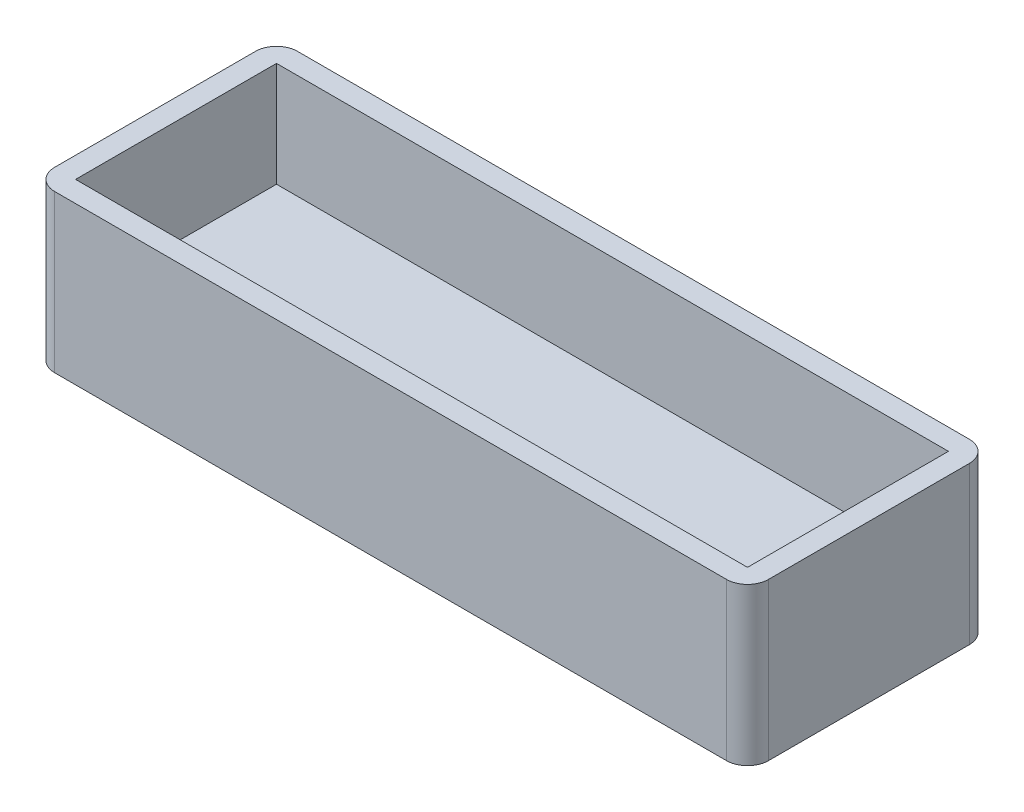
from build123d import *

# Parameters (mm, degrees)
SKETCH1_W           = 68.2
SKETCH1_H           = 23.2
SKETCH1_W_2         = 64.2
SKETCH1_H_2         = 19.2
BOSS_EXTRUDE1_DEPTH = 10
SKETCH1_2_W         = 68.2
SKETCH1_2_H         = 23.2
BOSS_EXTRUDE2_DEPTH = 5
SKETCH2_R           = 2.5
BOSS_EXTRUDE3_DEPTH = 5
FILLET1_R           = 2


with BuildPart() as part:
    # Sketch1 → Boss-Extrude1 (new body)
    with BuildSketch(Plane(origin=(0, 0, 0), x_dir=(1, 0, 0), z_dir=(0, 1, 0))):
        with Locations((32.1, 9.6)):
            Rectangle(SKETCH1_W, SKETCH1_H)
        with Locations((32.1, 9.6)):
            Rectangle(SKETCH1_W_2, SKETCH1_H_2, mode=Mode.SUBTRACT)
    extrude(amount=BOSS_EXTRUDE1_DEPTH)

    # Sketch1<2> → Boss-Extrude2 (add)
    with BuildSketch(Plane(origin=(0, 0, 0), x_dir=(1, 0, 0), z_dir=(0, 1, 0))):
        with Locations((32.1, 9.6)):
            Rectangle(SKETCH1_2_W, SKETCH1_2_H)
    extrude(amount=-BOSS_EXTRUDE2_DEPTH)

    # Sketch2 → Boss-Extrude3 (add)
    with BuildSketch(Plane.XZ.offset(5)):
        with Locations((14.6, -9.6)):
            Circle(SKETCH2_R)
        with Locations((49.6, -9.6)):
            Circle(SKETCH2_R)
    extrude(amount=BOSS_EXTRUDE3_DEPTH)

    # Fillet1
    fillet1_edges = [part.edges().sort_by_distance(p)[0] for p in [
        (-2, 2.5, -21.2),
        (-2, 2.5, 2),
        (66.2, 2.5, -21.2),
        (66.2, 2.5, 2),
    ]]
    fillet(fillet1_edges, radius=FILLET1_R)


solid = part.part
